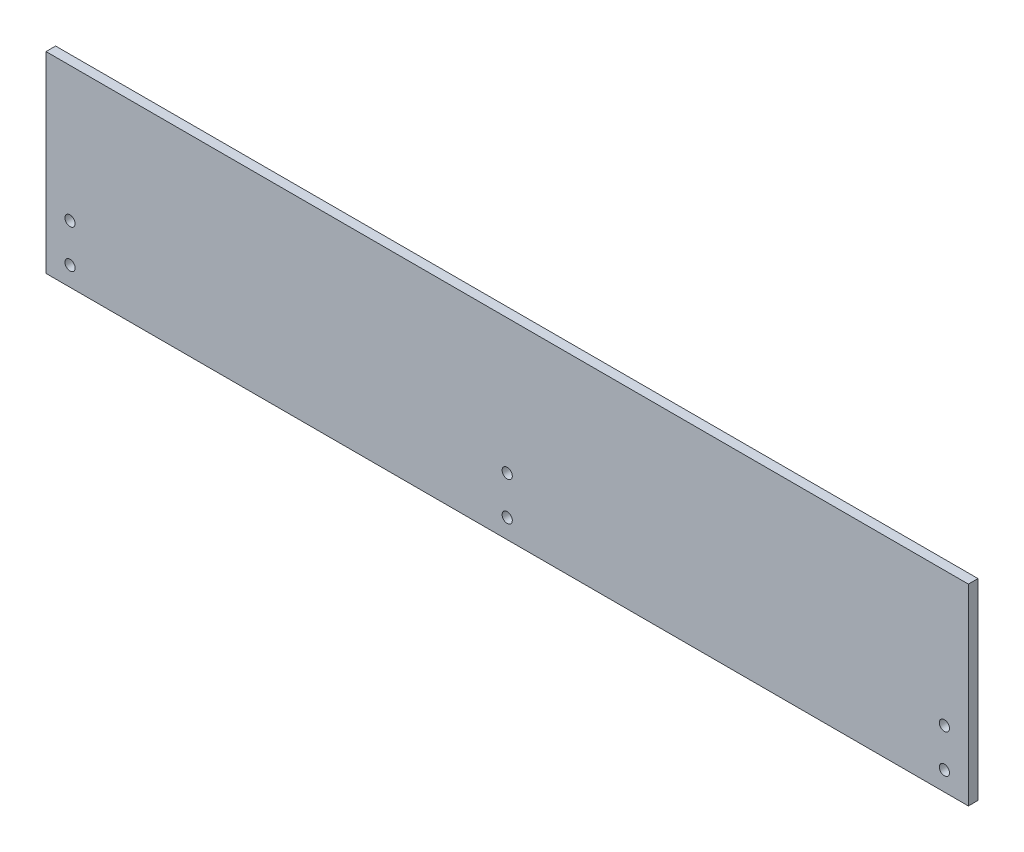
from build123d import *

# Parameters (mm, degrees)
SKETCH2_W           = 609.6
SKETCH2_H           = 127
BOSS_EXTRUDE1_DEPTH = 6.35
SKETCH3_R           = 3.3655
CUT_EXTRUDE1_DEPTH  = 6.35
SKETCH6_R           = 3.3655
CUT_EXTRUDE4_DEPTH  = 623.72103104


with BuildPart() as part:
    # Sketch2 → Boss-Extrude1 (new body)
    with BuildSketch(Plane.XY):
        with Locations((304.8, 63.5)):
            Rectangle(SKETCH2_W, SKETCH2_H)
    extrude(amount=BOSS_EXTRUDE1_DEPTH)

    # Sketch3 → Cut-Extrude1 (cut)
    with BuildSketch(Plane.XY.offset(6.35)):
        with Locations((15.875, 12.7)):
            Circle(SKETCH3_R)
        with Locations((593.725, 12.7)):
            Circle(SKETCH3_R)
        with Locations((593.725, 38.1)):
            Circle(SKETCH3_R)
        with Locations((15.875, 38.1)):
            Circle(SKETCH3_R)
    extrude(amount=-CUT_EXTRUDE1_DEPTH, mode=Mode.SUBTRACT)

    # Sketch6 → Cut-Extrude4 (cut, through all)
    with BuildSketch(Plane.XY.offset(6.35)):
        with Locations((304.8, 38.1)):
            Circle(SKETCH6_R)
        with Locations((304.8, 12.7)):
            Circle(SKETCH6_R)
    extrude(amount=-CUT_EXTRUDE4_DEPTH, mode=Mode.SUBTRACT)


solid = part.part
